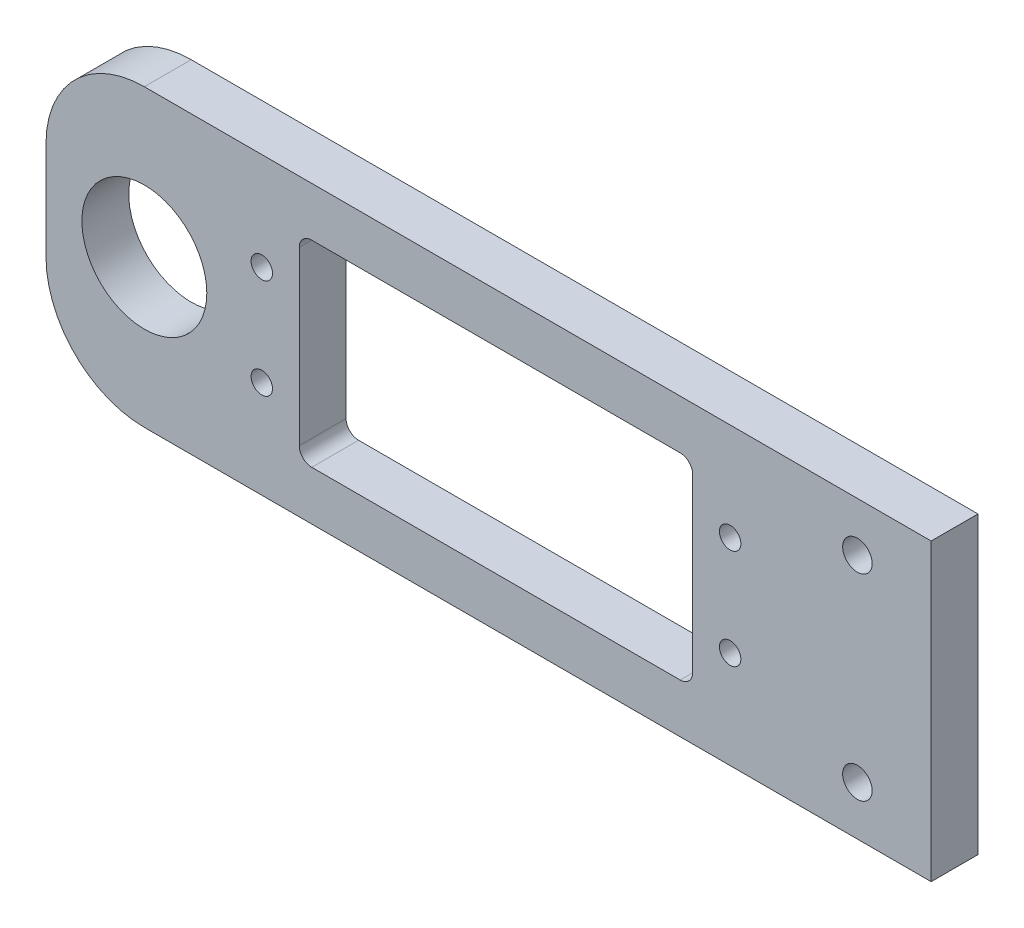
from build123d import *

# Parameters (mm, degrees)
ESQUISSE1_W             = 90
ESQUISSE1_H             = 30
BOSS_EXTRU_1_DEPTH      = 4.7625
CONG_1_R                = 10
ESQUISSE2_R             = 6.35
ENL_V_MAT_EXTRU_1_DEPTH = 6
ENL_V_MAT_EXTRU_2_REACH = 49.673
ESQUISSE3_W             = 40
ESQUISSE3_H             = 20
CONG_2_R                = 1.27
ENL_V_MAT_EXTRU_3_REACH = 49.673
ESQUISSE4_R             = 1.09
ENL_V_MAT_EXTRU_4_REACH = 49.673
ESQUISSE6_R             = 1.5


with BuildPart() as part:
    # Esquisse1 → Boss.-Extru.1 (new body)
    with BuildSketch(Plane.XY):
        Rectangle(ESQUISSE1_W, ESQUISSE1_H)
    extrude(amount=BOSS_EXTRU_1_DEPTH)

    # Congé1
    cong_1_edges = [part.edges().sort_by_distance(p)[0] for p in [
        (-45, -15, 2.38125),
        (-45, 15, 2.38125),
    ]]
    fillet(cong_1_edges, radius=CONG_1_R)

    # Esquisse2 → Enlèv. mat.-Extru.1 (cut)
    with BuildSketch(Plane.XY.offset(4.7625)):
        with Locations((-35, 0)):
            Circle(ESQUISSE2_R)
    extrude(amount=-ENL_V_MAT_EXTRU_1_DEPTH, mode=Mode.SUBTRACT)

    # Esquisse3 → Enlèv. mat.-Extru.2 (cut, up to next)
    with BuildSketch(Plane.XY.offset(4.7625), mode=Mode.PRIVATE) as enl_v_mat_extru_2_sk1:
        with Locations((0.75, 0)):
            Rectangle(ESQUISSE3_W, ESQUISSE3_H)
    enl_v_mat_extru_2_tool1 = extrude(enl_v_mat_extru_2_sk1.sketch, amount=-ENL_V_MAT_EXTRU_2_REACH, mode=Mode.PRIVATE) & part.part
    add(enl_v_mat_extru_2_tool1.solids().sort_by_distance((0.75, 0, 4.7625))[0], mode=Mode.SUBTRACT)

    # Congé2
    cong_2_edges = [part.edges().sort_by_distance(p)[0] for p in [
        (-19.25, -10, 2.38125),
        (-19.25, 10, 2.38125),
        (20.75, 10, 2.38125),
        (20.75, -10, 2.38125),
    ]]
    fillet(cong_2_edges, radius=CONG_2_R)

    # Esquisse4 → Enlèv. mat.-Extru.3 (cut, up to next)
    with BuildSketch(Plane.XY.offset(4.7625), mode=Mode.PRIVATE) as enl_v_mat_extru_3_sk1:
        with Locations((-23.06, 5.08)):
            Circle(ESQUISSE4_R)
    enl_v_mat_extru_3_tool1 = extrude(enl_v_mat_extru_3_sk1.sketch, amount=-ENL_V_MAT_EXTRU_3_REACH, mode=Mode.PRIVATE) & part.part
    # Esquisse4 → Enlèv. mat.-Extru.3 (cut, up to next)
    with BuildSketch(Plane.XY.offset(4.7625), mode=Mode.PRIVATE) as enl_v_mat_extru_3_sk2:
        with Locations((-23.06, -5.08)):
            Circle(ESQUISSE4_R)
    enl_v_mat_extru_3_tool2 = extrude(enl_v_mat_extru_3_sk2.sketch, amount=-ENL_V_MAT_EXTRU_3_REACH, mode=Mode.PRIVATE) & part.part
    # Esquisse4 → Enlèv. mat.-Extru.3 (cut, up to next)
    with BuildSketch(Plane.XY.offset(4.7625), mode=Mode.PRIVATE) as enl_v_mat_extru_3_sk3:
        with Locations((24.56, -5.08)):
            Circle(ESQUISSE4_R)
    enl_v_mat_extru_3_tool3 = extrude(enl_v_mat_extru_3_sk3.sketch, amount=-ENL_V_MAT_EXTRU_3_REACH, mode=Mode.PRIVATE) & part.part
    # Esquisse4 → Enlèv. mat.-Extru.3 (cut, up to next)
    with BuildSketch(Plane.XY.offset(4.7625), mode=Mode.PRIVATE) as enl_v_mat_extru_3_sk4:
        with Locations((24.56, 5.08)):
            Circle(ESQUISSE4_R)
    enl_v_mat_extru_3_tool4 = extrude(enl_v_mat_extru_3_sk4.sketch, amount=-ENL_V_MAT_EXTRU_3_REACH, mode=Mode.PRIVATE) & part.part
    add(enl_v_mat_extru_3_tool1.solids().sort_by_distance((-23.06, 5.08, 4.7625))[0], mode=Mode.SUBTRACT)
    add(enl_v_mat_extru_3_tool2.solids().sort_by_distance((-23.06, -5.08, 4.7625))[0], mode=Mode.SUBTRACT)
    add(enl_v_mat_extru_3_tool3.solids().sort_by_distance((24.56, -5.08, 4.7625))[0], mode=Mode.SUBTRACT)
    add(enl_v_mat_extru_3_tool4.solids().sort_by_distance((24.56, 5.08, 4.7625))[0], mode=Mode.SUBTRACT)

    # Esquisse6 → Enlèv. mat.-Extru.4 (cut, up to next)
    with BuildSketch(Plane.XY.offset(4.7625), mode=Mode.PRIVATE) as enl_v_mat_extru_4_sk1:
        with Locations((37.5, 10)):
            Circle(ESQUISSE6_R)
    enl_v_mat_extru_4_tool1 = extrude(enl_v_mat_extru_4_sk1.sketch, amount=-ENL_V_MAT_EXTRU_4_REACH, mode=Mode.PRIVATE) & part.part
    # Esquisse6 → Enlèv. mat.-Extru.4 (cut, up to next)
    with BuildSketch(Plane.XY.offset(4.7625), mode=Mode.PRIVATE) as enl_v_mat_extru_4_sk2:
        with Locations((37.5, -10)):
            Circle(ESQUISSE6_R)
    enl_v_mat_extru_4_tool2 = extrude(enl_v_mat_extru_4_sk2.sketch, amount=-ENL_V_MAT_EXTRU_4_REACH, mode=Mode.PRIVATE) & part.part
    add(enl_v_mat_extru_4_tool1.solids().sort_by_distance((37.5, 10, 4.7625))[0], mode=Mode.SUBTRACT)
    add(enl_v_mat_extru_4_tool2.solids().sort_by_distance((37.5, -10, 4.7625))[0], mode=Mode.SUBTRACT)


solid = part.part
